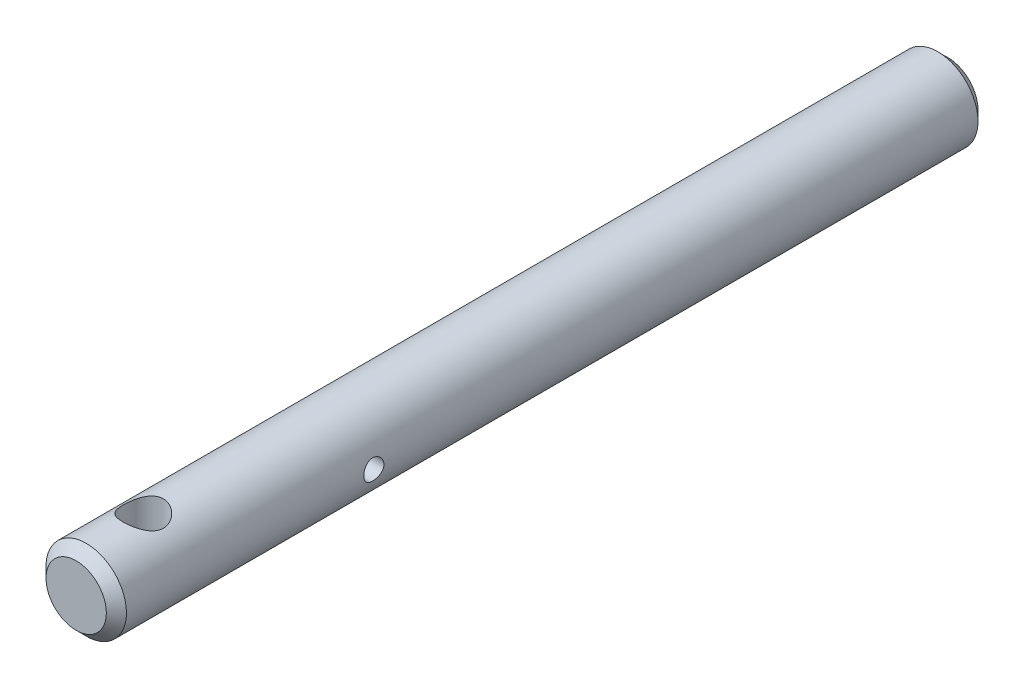
from build123d import *

# Parameters (mm, degrees)
ESQUISSE1_R             = 6
BASE_EXTRUSION_DEPTH    = 130
CHANFREIN1_SIZE         = 1.5
ESQUISSE4_R             = 3
ENL_V_MAT_EXTRU_1_DEPTH = 10
ESQUISSE6_R             = 1.5
ENL_V_MAT_EXTRU_2_DEPTH = 10


with BuildPart() as part:
    # Esquisse1 → Base-Extrusion (new body)
    with BuildSketch(Plane.XY):
        Circle(ESQUISSE1_R)
    extrude(amount=-BASE_EXTRUSION_DEPTH)

    # Chanfrein1
    chanfrein1_edges = [part.edges().sort_by_distance(p)[0] for p in [
        (-6, 0, 0),
        (-6, 0, -130),
    ]]
    chamfer(chanfrein1_edges, length=CHANFREIN1_SIZE)

    # Esquisse4 → Enlèv. mat.-Extru.1 (cut, symmetric)
    with BuildSketch(Plane(origin=(0, 0, 0), x_dir=(1, 0, 0), z_dir=(0, 1, 0))):
        with Locations(Location((0, 10, 0), (0, 0, 270))):
            Circle(ESQUISSE4_R)
    extrude(amount=ENL_V_MAT_EXTRU_1_DEPTH, both=True, mode=Mode.SUBTRACT)

    # Esquisse6 → Enlèv. mat.-Extru.2 (cut, symmetric)
    with BuildSketch(Plane(origin=(0, 0, 0), x_dir=(0, 0, -1), z_dir=(1, 0, 0))):
        with Locations((38.4, 0)):
            Circle(ESQUISSE6_R)
    extrude(amount=ENL_V_MAT_EXTRU_2_DEPTH, both=True, mode=Mode.SUBTRACT)


solid = part.part
